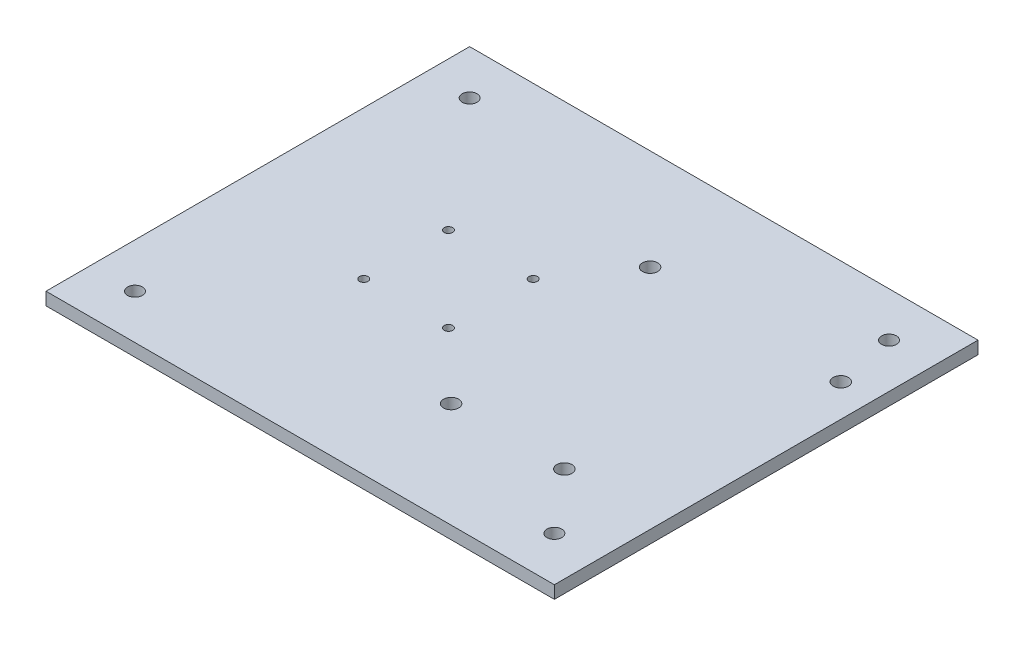
from build123d import *

# Parameters (mm, degrees)
SKETCH1_W           = 120
SKETCH1_H           = 100
BOSS_EXTRUDE1_DEPTH = 3
SKETCH2_R           = 1.75
HOLES_SPACERS_DEPTH = 10
HOLES_IMU_REACH     = 158.234
SKETCH3_R           = 1
HOLES_ARDUINO_REACH = 158.234
SKETCH4_R           = 1.8


with BuildPart() as part:
    # Sketch1 → Boss-Extrude1 (new body)
    with BuildSketch(Plane(origin=(0, 0, 0), x_dir=(1, 0, 0), z_dir=(0, 1, 0))):
        with Locations((60, 50)):
            Rectangle(SKETCH1_W, SKETCH1_H)
    extrude(amount=BOSS_EXTRUDE1_DEPTH)

    # Sketch2 → holes_spacers (cut)
    with BuildSketch(Plane(origin=(0, 3, 0), x_dir=(1, 0, 0), z_dir=(0, 1, 0))):
        with Locations(Location((10.5, 89.5, 0), (0, 0, 270))):
            Circle(SKETCH2_R)
        with Locations(Location((109.5, 89.5, 0), (0, 0, 270))):
            Circle(SKETCH2_R)
        with Locations(Location((109.5, 10.5, 0), (0, 0, 270))):
            Circle(SKETCH2_R)
        with Locations(Location((10.5, 10.5, 0), (0, 0, 270))):
            Circle(SKETCH2_R)
    extrude(amount=-HOLES_SPACERS_DEPTH, mode=Mode.SUBTRACT)

    # Sketch3 → holes_IMU (cut, up to next)
    with BuildSketch(Plane(origin=(0, 3, 0), x_dir=(1, 0, 0), z_dir=(0, 1, 0)), mode=Mode.PRIVATE) as holes_imu_sk1:
        with Locations(Location((35, 60, 0), (0, 0, 270))):
            Circle(SKETCH3_R)
    holes_imu_tool1 = extrude(holes_imu_sk1.sketch, amount=-HOLES_IMU_REACH, mode=Mode.PRIVATE) & part.part
    # Sketch3 → holes_IMU (cut, up to next)
    with BuildSketch(Plane(origin=(0, 3, 0), x_dir=(1, 0, 0), z_dir=(0, 1, 0)), mode=Mode.PRIVATE) as holes_imu_sk2:
        with Locations(Location((55, 60, 0), (0, 0, 270))):
            Circle(SKETCH3_R)
    holes_imu_tool2 = extrude(holes_imu_sk2.sketch, amount=-HOLES_IMU_REACH, mode=Mode.PRIVATE) & part.part
    # Sketch3 → holes_IMU (cut, up to next)
    with BuildSketch(Plane(origin=(0, 3, 0), x_dir=(1, 0, 0), z_dir=(0, 1, 0)), mode=Mode.PRIVATE) as holes_imu_sk3:
        with Locations(Location((55, 40, 0), (0, 0, 270))):
            Circle(SKETCH3_R)
    holes_imu_tool3 = extrude(holes_imu_sk3.sketch, amount=-HOLES_IMU_REACH, mode=Mode.PRIVATE) & part.part
    # Sketch3 → holes_IMU (cut, up to next)
    with BuildSketch(Plane(origin=(0, 3, 0), x_dir=(1, 0, 0), z_dir=(0, 1, 0)), mode=Mode.PRIVATE) as holes_imu_sk4:
        with Locations(Location((35, 40, 0), (0, 0, 270))):
            Circle(SKETCH3_R)
    holes_imu_tool4 = extrude(holes_imu_sk4.sketch, amount=-HOLES_IMU_REACH, mode=Mode.PRIVATE) & part.part
    add(holes_imu_tool1.solids().sort_by_distance((35, 3, -60))[0], mode=Mode.SUBTRACT)
    add(holes_imu_tool2.solids().sort_by_distance((55, 3, -60))[0], mode=Mode.SUBTRACT)
    add(holes_imu_tool3.solids().sort_by_distance((55, 3, -40))[0], mode=Mode.SUBTRACT)
    add(holes_imu_tool4.solids().sort_by_distance((35, 3, -40))[0], mode=Mode.SUBTRACT)

    # Sketch4 → holes_arduino (cut, up to next)
    with BuildSketch(Plane(origin=(0, 3, 0), x_dir=(1, 0, 0), z_dir=(0, 1, 0)), mode=Mode.PRIVATE) as holes_arduino_sk1:
        with Locations(Location((66.389668811, 76.207441627, 0), (0, 0, 270))):
            Circle(SKETCH4_R)
    holes_arduino_tool1 = extrude(holes_arduino_sk1.sketch, amount=-HOLES_ARDUINO_REACH, mode=Mode.PRIVATE) & part.part
    # Sketch4 → holes_arduino (cut, up to next)
    with BuildSketch(Plane(origin=(0, 3, 0), x_dir=(1, 0, 0), z_dir=(0, 1, 0)), mode=Mode.PRIVATE) as holes_arduino_sk2:
        with Locations(Location((112.329668811, 75.287441627, 0), (0, 0, 270))):
            Circle(SKETCH4_R)
    holes_arduino_tool2 = extrude(holes_arduino_sk2.sketch, amount=-HOLES_ARDUINO_REACH, mode=Mode.PRIVATE) & part.part
    # Sketch4 → holes_arduino (cut, up to next)
    with BuildSketch(Plane(origin=(0, 3, 0), x_dir=(1, 0, 0), z_dir=(0, 1, 0)), mode=Mode.PRIVATE) as holes_arduino_sk3:
        with Locations(Location((97.519668811, 24.837441627, 0), (0, 0, 270))):
            Circle(SKETCH4_R)
    holes_arduino_tool3 = extrude(holes_arduino_sk3.sketch, amount=-HOLES_ARDUINO_REACH, mode=Mode.PRIVATE) & part.part
    # Sketch4 → holes_arduino (cut, up to next)
    with BuildSketch(Plane(origin=(0, 3, 0), x_dir=(1, 0, 0), z_dir=(0, 1, 0)), mode=Mode.PRIVATE) as holes_arduino_sk4:
        with Locations(Location((70.779668811, 24.837441627, 0), (0, 0, 270))):
            Circle(SKETCH4_R)
    holes_arduino_tool4 = extrude(holes_arduino_sk4.sketch, amount=-HOLES_ARDUINO_REACH, mode=Mode.PRIVATE) & part.part
    add(holes_arduino_tool1.solids().sort_by_distance((66.389669, 3, -76.207442))[0], mode=Mode.SUBTRACT)
    add(holes_arduino_tool2.solids().sort_by_distance((112.329669, 3, -75.287442))[0], mode=Mode.SUBTRACT)
    add(holes_arduino_tool3.solids().sort_by_distance((97.519669, 3, -24.837442))[0], mode=Mode.SUBTRACT)
    add(holes_arduino_tool4.solids().sort_by_distance((70.779669, 3, -24.837442))[0], mode=Mode.SUBTRACT)


solid = part.part
